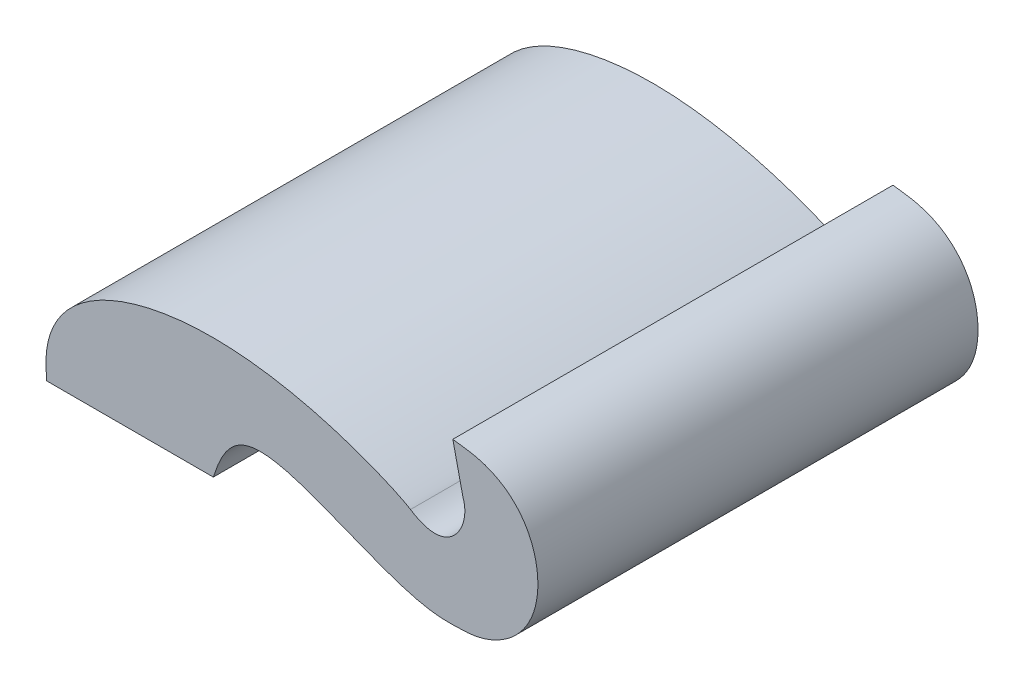
from build123d import *

# Parameters (mm, degrees)
BOSS_EXTRUDE1_DEPTH = 430
CUT_EXTRUDE1_DEPTH  = 400
BOSS_EXTRUDE3_DEPTH = 10
SKETCH3_W           = 120
SKETCH3_H           = 400
CUT_EXTRUDE2_DEPTH  = 10
SKETCH4_W           = 400.340915757
SKETCH4_H           = 36.518631982
CUT_EXTRUDE3_DEPTH  = 10


with BuildPart() as part:
    # Sketch2 → Boss-Extrude1 (new body)
    with BuildSketch(Plane.XY):
        with BuildLine():
            Line((-9.411080071, -10), (157.150370754, -10))
            add(Edge.make_bspline(
                [(157.150370754, -10), (157.580754289, -8.740632933), (158.22845819, -6.844981527), (158.976662643, -4.656491037), (159.414851043, -3.37292102), (159.813305582, -2.21256602), (160.322614818, -0.78594611), (161.149077972, 1.427628126), (162.632502011, 5.133483712), (164.84793535, 9.949411679), (167.641411024, 14.994563261), (170.548504218, 19.342138654), (174.5547329, 24.271703619), (179.775314015, 28.94806908), (186.498764429, 32.705322326), (194.041692122, 34.983423059), (202.707287891, 35.875613786), (215.867115788, 35.215111685), (231.315466942, 31.851573204), (248.688062505, 26.342938062), (262.61185196, 21.334808612), (277.375895782, 15.642377325), (290.344732196, 10.495678759), (301.103022181, 6.237122668), (309.358917224, 2.998297077), (316.395450119, 0.281758806), (322.109639981, -1.886561544), (325.00763723, -2.97159511), (326.453405677, -3.508955548)],
                knots=[-0.02879182, -0.02879182, -0.02879182, -0.02879182, -0.012715007, -0.004676601, -0.000657398, 0.003361805, 0.011400212, 0.019438618, 0.03551543, 0.067669055, 0.09982268, 0.131976305, 0.16412993, 0.22843718, 0.29274443, 0.35705168, 0.42135893, 0.48566618, 0.61428068, 0.67858793, 0.74289518, 0.80720243, 0.87150968, 0.903663305, 0.93581693, 0.967970555, 0.984047367, 1.00012418, 1.00012418, 1.00012418, 1.00012418], degree=3))
            add(Edge.make_bspline(
                [(326.453405677, -3.508955548), (327.231983115, -3.792057864), (328.803981412, -4.359469792), (331.845575043, -5.43951604), (335.53084849, -6.715318628), (339.75205044, -8.123919092), (345.131444912, -9.848368634), (351.406297311, -11.726449157), (358.284699092, -13.57456935), (364.576387393, -15.054061357), (372.265688941, -16.583572615), (380.713637593, -17.753471339), (389.385990051, -18.259242074), (395.621614954, -18.212377057), (400.179640308, -18.077194273), (404.464538199, -17.946438628), (409.078854161, -17.808912221), (414.010499252, -17.413743473), (419.168530959, -16.741500843), (425.582964406, -15.356715013), (433.191646349, -12.853943027), (443.084309663, -8.401380686), (454.757294459, -0.755150647), (466.834821371, 11.744435198), (474.50166918, 24.877849933), (478.71178933, 36.880156735), (481.485250864, 49.835982051), (482.072970745, 67.314707098), (477.676386387, 88.906158438), (469.060408212, 106.044687333), (458.787200286, 118.191946749), (450.915766142, 124.872222991), (443.747064271, 129.519915467), (437.939350026, 132.623030189), (431.705692779, 135.31198963), (426.160369223, 137.184396457), (421.516807051, 138.448874509), (417.928795449, 139.277985374), (414.858224637, 139.866407224), (412.652767826, 140.225118982), (411.553624428, 140.388811597), (410.898363964, 140.481431283), (410.331087469, 140.559979969), (409.601401443, 140.661639116), (408.445394431, 140.822355457), (406.417036835, 141.104510728), (402.364139732, 141.668177217), (398.888918871, 142.15154074), (396.572395865, 142.473734018)],
                knots=[-5.8126e-05, -5.8126e-05, -5.8126e-05, -5.8126e-05, 0.003978119, 0.008014363, 0.016086852, 0.024159341, 0.03223183, 0.048376808, 0.064521786, 0.080666764, 0.096811742, 0.129101698, 0.161391654, 0.19368161, 0.209826588, 0.225971566, 0.258261522, 0.2744065, 0.290551478, 0.322841434, 0.35513139, 0.387421346, 0.452001258, 0.51658117, 0.581161083, 0.613451039, 0.645740995, 0.710320907, 0.774900819, 0.839480731, 0.871770687, 0.904060643, 0.920205621, 0.936350599, 0.952495577, 0.968640555, 0.976713044, 0.984785533, 0.992858022, 0.996894266, 0.998912389, 0.99992145, 1.000930511, 1.002948633, 1.004966755, 1.009003, 1.017075489, 1.033220467, 1.033220467, 1.033220467, 1.033220467], degree=3))
            Line((396.572395865, 142.473734018), (406.772029175, 97.085365791))
            add(Edge.make_bspline(
                [(406.772029175, 97.085365791), (406.814669757, 96.959187077), (406.880782086, 96.763417963), (406.96032604, 96.52839665), (407.01884597, 96.352460033), (407.097168783, 96.111253867), (407.214980722, 95.734845283), (407.356702948, 95.256962823), (407.568064961, 94.487349613), (407.80498765, 93.51154704), (408.124982226, 91.924893098), (408.413980933, 89.897117561), (408.750925861, 84.918965581), (407.905060669, 77.150737806), (404.045649556, 67.355358719), (397.893438505, 59.309586764), (391.359833164, 54.782591457), (385.377559676, 52.672589119), (380.433361465, 51.902896121), (374.927443994, 52.065693156), (369.791271335, 53.136582387), (365.334099385, 54.671083137), (361.821042779, 56.189063072), (358.747762671, 57.788471824), (356.221350955, 59.271545463), (354.908591474, 60.101144176), (354.268139939, 60.520074671)],
                knots=[0.000565556, 0.000565556, 0.000565556, 0.000565556, 0.004489726, 0.006451811, 0.008413896, 0.012338066, 0.016262235, 0.024110575, 0.031958915, 0.047655594, 0.063352273, 0.094745631, 0.126138989, 0.251712422, 0.377285854, 0.502859287, 0.62843272, 0.691219436, 0.754006152, 0.816792869, 0.879579585, 0.910972943, 0.942366301, 0.97375966, 0.989456339, 1.005153018, 1.005153018, 1.005153018, 1.005153018], degree=3))
            add(Edge.make_bspline(
                [(354.268139939, 60.520074671), (353.777800145, 60.852507541), (352.812631774, 61.461834904), (351.105582333, 62.456216225), (349.1056392, 63.552413515), (346.011831901, 65.170507626), (341.333919818, 67.481538984), (334.450387873, 70.662046253), (326.359238305, 74.172470901), (314.054743226, 79.183348776), (296.01761156, 85.854140497), (270.738283152, 93.818232818), (242.446814704, 101.039639942), (211.765368911, 106.810566668), (179.311020126, 110.411033093), (145.710042583, 111.118512832), (111.556957194, 108.151195789), (78.419434565, 101.153001834), (47.868489992, 89.747979526), (25.885203485, 76.10065503), (11.332454911, 62.3188908), (2.245572246, 50.470913904), (-3.513790908, 39.324814461), (-6.861118923, 29.687229648), (-8.705748295, 22.117985096), (-9.854238476, 14.228276649), (-10.175903594, 8.083092494), (-10.160102416, 3.899381127), (-10.114738681, 2.137627906), (-10.055656336, 0.728253301), (-10.007936995, -0.176357262), (-9.966387733, -0.856150357), (-9.928014126, -1.489028735), (-9.859380871, -2.618422072), (-9.762105601, -4.220432681), (-9.606031633, -6.790054397), (-9.489073702, -8.715829616), (-9.411080071, -10)],
                knots=[-0.019398998, -0.019398998, -0.019398998, -0.019398998, -0.00348742, 0.012424158, 0.028335736, 0.044247314, 0.07607047, 0.107893626, 0.139716781, 0.171539937, 0.235186249, 0.298832561, 0.362478873, 0.426125185, 0.489771497, 0.553417809, 0.617064121, 0.680710432, 0.744356744, 0.808003056, 0.839826212, 0.871649368, 0.903472524, 0.919384102, 0.93529568, 0.951207258, 0.967118836, 0.97109673, 0.975074625, 0.977063572, 0.979052519, 0.980046993, 0.981041467, 0.983030414, 0.987008308, 0.990986203, 0.998941992, 0.998941992, 0.998941992, 0.998941992], degree=3))
        make_face()
    extrude(amount=-BOSS_EXTRUDE1_DEPTH)

    # Sketch2<5> → Cut-Extrude1 (cut)
    with BuildSketch(Plane.XY):
        with BuildLine():
            add(Edge.make_bspline(
                [(0, 0), (-4.079144054, 67.163381692), (172.035267423, 138.138110752), (338.302987424, 59.334289972), (348.714013286, 52.203840123)],
                knots=[0, 0, 0, 0, 0.416095636, 1, 1, 1, 1], degree=3))
            Line((0, 0), (150, 0))
            add(Edge.make_bspline(
                [(150, 0), (176.770451835, 78.334375544), (240.542641434, 39.090578195), (329.90403543, 5.876906995)],
                knots=[0, 0, 0, 0, 1, 1, 1, 1], degree=3))
            Line((329.90403543, 5.876906995), (446.023764604, 5.876906995))
            add(Edge.make_bspline(
                [(446.023764604, 5.876906995), (457.32952905, 14.545319967), (484.099946341, 52.258976086), (462.700300325, 123.180083989), (409.494482154, 130.58020776)],
                knots=[0.440622993, 0.440622993, 0.440622993, 0.440622993, 0.629182718, 1, 1, 1, 1], degree=3))
            Line((409.494482154, 130.58020776), (416.413674234, 99.789803007))
            add(Edge.make_bspline(
                [(348.714013286, 52.203840123), (395.899476232, 21.263286814), (427.279815451, 67.635558575), (416.413674234, 99.789803007)],
                knots=[0, 0, 0, 0, 1, 1, 1, 1], degree=3))
        make_face()
    extrude(amount=-CUT_EXTRUDE1_DEPTH, mode=Mode.SUBTRACT)

    # Sketch2<6> → Boss-Extrude3 (add)
    with BuildSketch(Plane.XY):
        with BuildLine():
            Line((-9.411080071, -10), (157.150370754, -10))
            add(Edge.make_bspline(
                [(157.150370754, -10), (157.580754289, -8.740632933), (158.22845819, -6.844981527), (158.976662643, -4.656491037), (159.414851043, -3.37292102), (159.813305582, -2.21256602), (160.322614818, -0.78594611), (161.149077972, 1.427628126), (162.632502011, 5.133483712), (164.84793535, 9.949411679), (167.641411024, 14.994563261), (170.548504218, 19.342138654), (174.5547329, 24.271703619), (179.775314015, 28.94806908), (186.498764429, 32.705322326), (194.041692122, 34.983423059), (202.707287891, 35.875613786), (215.867115788, 35.215111685), (231.315466942, 31.851573204), (248.688062505, 26.342938062), (262.61185196, 21.334808612), (277.375895782, 15.642377325), (290.344732196, 10.495678759), (301.103022181, 6.237122668), (309.358917224, 2.998297077), (316.395450119, 0.281758806), (322.109639981, -1.886561544), (325.00763723, -2.97159511), (326.453405677, -3.508955548)],
                knots=[-0.02879182, -0.02879182, -0.02879182, -0.02879182, -0.012715007, -0.004676601, -0.000657398, 0.003361805, 0.011400212, 0.019438618, 0.03551543, 0.067669055, 0.09982268, 0.131976305, 0.16412993, 0.22843718, 0.29274443, 0.35705168, 0.42135893, 0.48566618, 0.61428068, 0.67858793, 0.74289518, 0.80720243, 0.87150968, 0.903663305, 0.93581693, 0.967970555, 0.984047367, 1.00012418, 1.00012418, 1.00012418, 1.00012418], degree=3))
            add(Edge.make_bspline(
                [(326.453405677, -3.508955548), (327.231983115, -3.792057864), (328.803981412, -4.359469792), (331.845575043, -5.43951604), (335.53084849, -6.715318628), (339.75205044, -8.123919092), (345.131444912, -9.848368634), (351.406297311, -11.726449157), (358.284699092, -13.57456935), (364.576387393, -15.054061357), (372.265688941, -16.583572615), (380.713637593, -17.753471339), (389.385990051, -18.259242074), (395.621614954, -18.212377057), (400.179640308, -18.077194273), (404.464538199, -17.946438628), (409.078854161, -17.808912221), (414.010499252, -17.413743473), (419.168530959, -16.741500843), (425.582964406, -15.356715013), (433.191646349, -12.853943027), (443.084309663, -8.401380686), (454.757294459, -0.755150647), (466.834821371, 11.744435198), (474.50166918, 24.877849933), (478.71178933, 36.880156735), (481.485250864, 49.835982051), (482.072970745, 67.314707098), (477.676386387, 88.906158438), (469.060408212, 106.044687333), (458.787200286, 118.191946749), (450.915766142, 124.872222991), (443.747064271, 129.519915467), (437.939350026, 132.623030189), (431.705692779, 135.31198963), (426.160369223, 137.184396457), (421.516807051, 138.448874509), (417.928795449, 139.277985374), (414.858224637, 139.866407224), (412.652767826, 140.225118982), (411.553624428, 140.388811597), (410.898363964, 140.481431283), (410.331087469, 140.559979969), (409.601401443, 140.661639116), (408.445394431, 140.822355457), (406.417036835, 141.104510728), (402.364139732, 141.668177217), (398.888918871, 142.15154074), (396.572395865, 142.473734018)],
                knots=[-5.8126e-05, -5.8126e-05, -5.8126e-05, -5.8126e-05, 0.003978119, 0.008014363, 0.016086852, 0.024159341, 0.03223183, 0.048376808, 0.064521786, 0.080666764, 0.096811742, 0.129101698, 0.161391654, 0.19368161, 0.209826588, 0.225971566, 0.258261522, 0.2744065, 0.290551478, 0.322841434, 0.35513139, 0.387421346, 0.452001258, 0.51658117, 0.581161083, 0.613451039, 0.645740995, 0.710320907, 0.774900819, 0.839480731, 0.871770687, 0.904060643, 0.920205621, 0.936350599, 0.952495577, 0.968640555, 0.976713044, 0.984785533, 0.992858022, 0.996894266, 0.998912389, 0.99992145, 1.000930511, 1.002948633, 1.004966755, 1.009003, 1.017075489, 1.033220467, 1.033220467, 1.033220467, 1.033220467], degree=3))
            Line((396.572395865, 142.473734018), (406.772029175, 97.085365791))
            add(Edge.make_bspline(
                [(406.772029175, 97.085365791), (406.814669757, 96.959187077), (406.880782086, 96.763417963), (406.96032604, 96.52839665), (407.01884597, 96.352460033), (407.097168783, 96.111253867), (407.214980722, 95.734845283), (407.356702948, 95.256962823), (407.568064961, 94.487349613), (407.80498765, 93.51154704), (408.124982226, 91.924893098), (408.413980933, 89.897117561), (408.750925861, 84.918965581), (407.905060669, 77.150737806), (404.045649556, 67.355358719), (397.893438505, 59.309586764), (391.359833164, 54.782591457), (385.377559676, 52.672589119), (380.433361465, 51.902896121), (374.927443994, 52.065693156), (369.791271335, 53.136582387), (365.334099385, 54.671083137), (361.821042779, 56.189063072), (358.747762671, 57.788471824), (356.221350955, 59.271545463), (354.908591474, 60.101144176), (354.268139939, 60.520074671)],
                knots=[0.000565556, 0.000565556, 0.000565556, 0.000565556, 0.004489726, 0.006451811, 0.008413896, 0.012338066, 0.016262235, 0.024110575, 0.031958915, 0.047655594, 0.063352273, 0.094745631, 0.126138989, 0.251712422, 0.377285854, 0.502859287, 0.62843272, 0.691219436, 0.754006152, 0.816792869, 0.879579585, 0.910972943, 0.942366301, 0.97375966, 0.989456339, 1.005153018, 1.005153018, 1.005153018, 1.005153018], degree=3))
            add(Edge.make_bspline(
                [(354.268139939, 60.520074671), (353.777800145, 60.852507541), (352.812631774, 61.461834904), (351.105582333, 62.456216225), (349.1056392, 63.552413515), (346.011831901, 65.170507626), (341.333919818, 67.481538984), (334.450387873, 70.662046253), (326.359238305, 74.172470901), (314.054743226, 79.183348776), (296.01761156, 85.854140497), (270.738283152, 93.818232818), (242.446814704, 101.039639942), (211.765368911, 106.810566668), (179.311020126, 110.411033093), (145.710042583, 111.118512832), (111.556957194, 108.151195789), (78.419434565, 101.153001834), (47.868489992, 89.747979526), (25.885203485, 76.10065503), (11.332454911, 62.3188908), (2.245572246, 50.470913904), (-3.513790908, 39.324814461), (-6.861118923, 29.687229648), (-8.705748295, 22.117985096), (-9.854238476, 14.228276649), (-10.175903594, 8.083092494), (-10.160102416, 3.899381127), (-10.114738681, 2.137627906), (-10.055656336, 0.728253301), (-10.007936995, -0.176357262), (-9.966387733, -0.856150357), (-9.928014126, -1.489028735), (-9.859380871, -2.618422072), (-9.762105601, -4.220432681), (-9.606031633, -6.790054397), (-9.489073702, -8.715829616), (-9.411080071, -10)],
                knots=[-0.019398998, -0.019398998, -0.019398998, -0.019398998, -0.00348742, 0.012424158, 0.028335736, 0.044247314, 0.07607047, 0.107893626, 0.139716781, 0.171539937, 0.235186249, 0.298832561, 0.362478873, 0.426125185, 0.489771497, 0.553417809, 0.617064121, 0.680710432, 0.744356744, 0.808003056, 0.839826212, 0.871649368, 0.903472524, 0.919384102, 0.93529568, 0.951207258, 0.967118836, 0.97109673, 0.975074625, 0.977063572, 0.979052519, 0.980046993, 0.981041467, 0.983030414, 0.987008308, 0.990986203, 0.998941992, 0.998941992, 0.998941992, 0.998941992], degree=3))
        make_face()
    extrude(amount=BOSS_EXTRUDE3_DEPTH)

    # Sketch3 → Cut-Extrude2 (cut)
    with BuildSketch(Plane.XZ.offset(10)):
        with Locations((60, -200)):
            Rectangle(SKETCH3_W, SKETCH3_H)
    extrude(amount=-CUT_EXTRUDE2_DEPTH, mode=Mode.SUBTRACT)

    # Sketch4 → Cut-Extrude3 (cut)
    with BuildSketch(Plane(origin=(407.986202884, 91.682292783, 0), x_dir=(0, 0, 1), z_dir=(-0.9756684143216708, -0.2192513290610495, 0))):
        with Locations((-200.170457879, 28.798781298)):
            Rectangle(SKETCH4_W, SKETCH4_H)
    extrude(amount=-CUT_EXTRUDE3_DEPTH, mode=Mode.SUBTRACT)


solid = part.part
